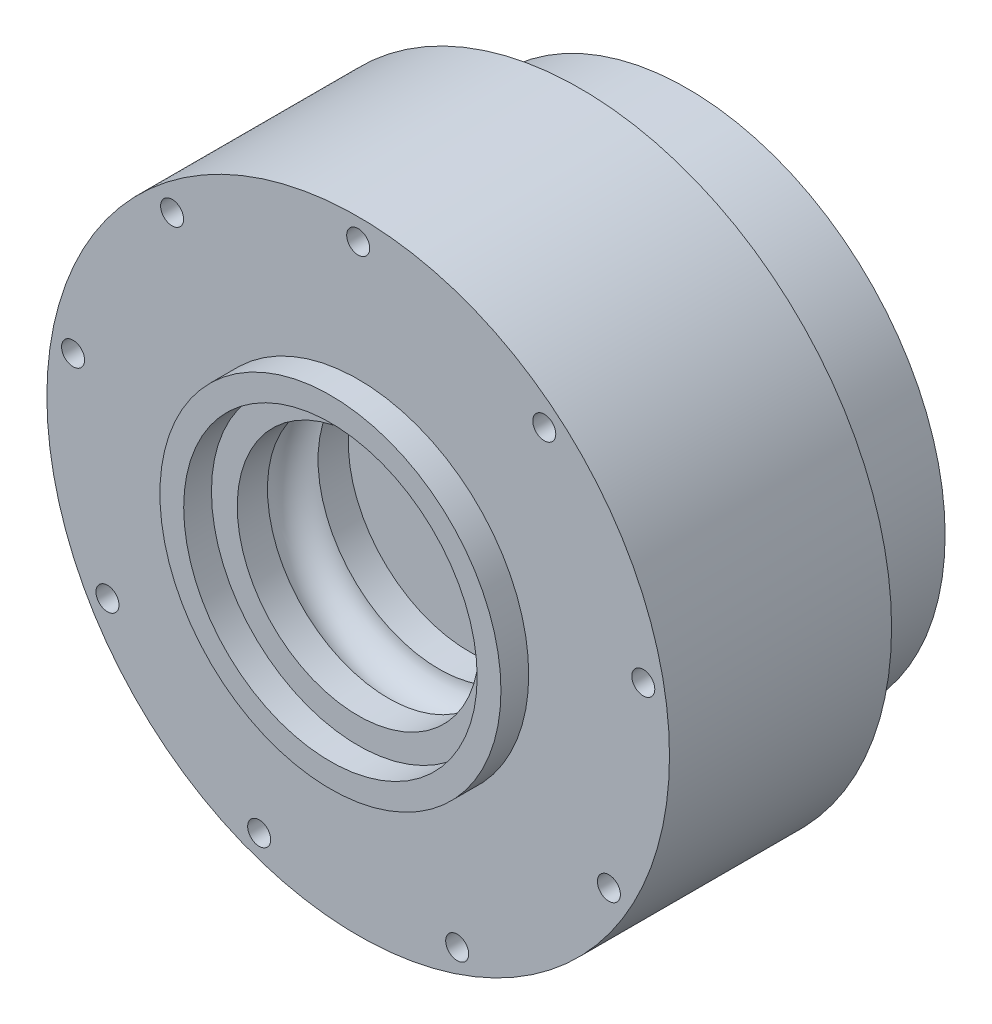
from build123d import *

# Parameters (mm, degrees)
F_3_0MM_DOWEL_HOLE3_D   = 2.9
CUT_EXTRUDE1_DEPTH      = 70.306384987
CUT_EXTRUDE1_DEPTH_BACK = 6
SKETCH15_R              = 3.2


with BuildPart() as part:
    # Sketch12 → Revolve2 (revolve)
    with BuildSketch(Plane(origin=(0, 0, 0), x_dir=(0, 0, -1), z_dir=(1, 0, 0)), mode=Mode.PRIVATE) as revolve2_sk:
        with BuildLine():
            ThreePointArc((-17.809780572, 15.25), (-21, 18.2), (-24.190219428, 15.25))
            Line((-24.190219428, 15.25), (-28, 15.25))
            Line((-28, 15.25), (-28, 18.5))
            Line((-28, 18.5), (-31.5, 18.5))
            Line((-31.5, 18.5), (-31.5, 21.5))
            Line((-31.5, 21.5), (-28, 21.5))
            Line((-28, 21.5), (-28, 39.25))
            Line((-28, 39.25), (0, 39.25))
            Line((0, 39.25), (0, 32.5))
            Line((0, 32.5), (13.5, 32.5))
            Line((13.5, 32.5), (13.5, 0))
            Line((13.5, 0), (-14, 0))
            Line((-14, 0), (-14, 15.25))
            Line((-14, 15.25), (-17.809780572, 15.25))
        make_face()
    revolve(revolve2_sk.sketch.rotate(Axis((0, 0, 41.148719721), (0, 0, -1)), 90), axis=Axis((0, 0, 41.148719721), (0, 0, -1)))

    # Ø3.0mm Dowel Hole3 (through all)
    with Locations(Plane.XY.offset(28)):
        with Locations((-23.461747754, 27.960622174), (0, 36.5), (23.461747754, 27.960622174), (35.945482985, 6.338158485), (31.609927238, -18.25), (12.483735231, -34.298780659), (-12.483735231, -34.298780659), (-31.609927238, -18.25), (-35.945482985, 6.338158485)):
            Hole(F_3_0MM_DOWEL_HOLE3_D / 2)

    # Sketch15 → Cut-Extrude1 (cut, two sides: drawn at the far end of the back side and taken through both)
    with BuildSketch(Plane.XY.offset(28).offset(-CUT_EXTRUDE1_DEPTH_BACK)):
        with Locations((0, 15)):
            Circle(SKETCH15_R)
    extrude(amount=CUT_EXTRUDE1_DEPTH + CUT_EXTRUDE1_DEPTH_BACK, mode=Mode.SUBTRACT)


solid = part.part
